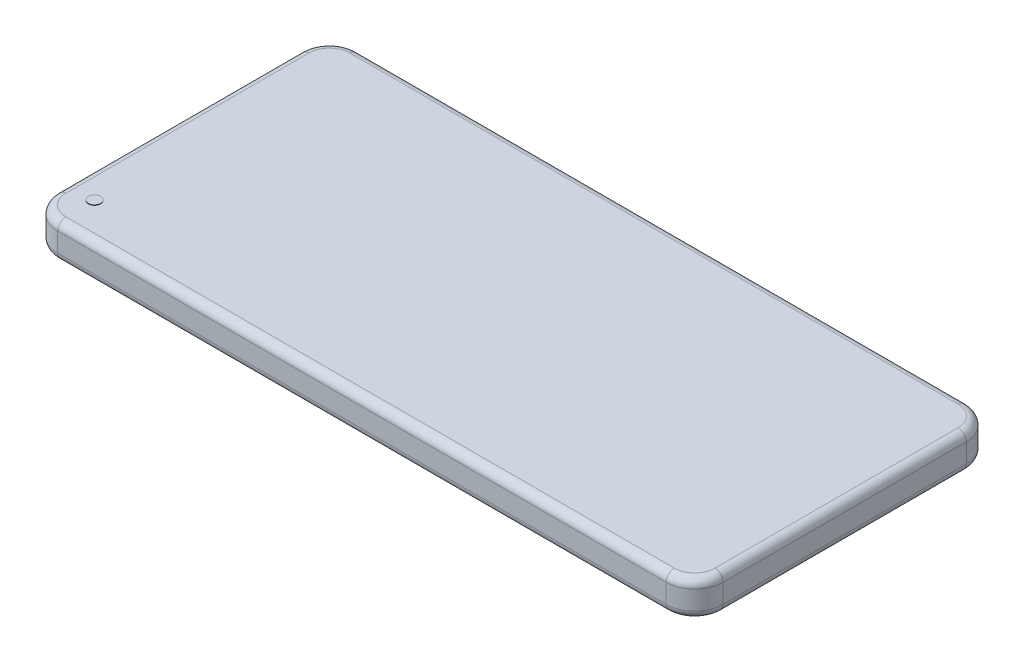
from build123d import *

# Parameters (mm, degrees)
SKETCH1_W           = 163.2
SKETCH1_H           = 73.6
BOSS_EXTRUDE1_DEPTH = 8.7
FILLET1_R           = 7
FILLET2_R           = 2
SKETCH2_R           = 1.5
BOSS_EXTRUDE2_DEPTH = 0.1
FILLET3_R           = 2
SKETCH3_W           = 40
SKETCH3_H           = 22
BOSS_EXTRUDE3_DEPTH = 1
FILLET4_R           = 4
CUT_EXTRUDE1_DEPTH  = 1
SKETCH5_R           = 5
SKETCH5_R_2         = 2.5
SKETCH5_R_3         = 2
BOSS_EXTRUDE4_DEPTH = 1
SKETCH6_R           = 4
SKETCH6_R_2         = 1.4
SKETCH6_R_3         = 1
BOSS_EXTRUDE5_DEPTH = 0.1


with BuildPart() as part:
    # Sketch1 → Boss-Extrude1 (new body)
    with BuildSketch(Plane(origin=(0, 0, 0), x_dir=(1, 0, 0), z_dir=(0, 1, 0))):
        Rectangle(SKETCH1_W, SKETCH1_H)
    extrude(amount=BOSS_EXTRUDE1_DEPTH)

    # Fillet1
    fillet1_edges = [part.edges().sort_by_distance(p)[0] for p in [
        (81.6, 4.35, 36.8),
        (-81.6, 4.35, 36.8),
        (-81.6, 4.35, -36.8),
        (81.6, 4.35, -36.8),
    ]]
    fillet(fillet1_edges, radius=FILLET1_R)

    # Fillet2
    fillet2_edges = [part.edges().sort_by_distance(p)[0] for p in [
        (81.6, 8.7, 0),
        (0, 8.7, 36.8),
        (0, 8.7, -36.8),
        (-81.6, 8.7, 0),
        (-79.549747468, 8.7, 34.749747468),
        (-79.549747468, 8.7, -34.749747468),
        (79.549747468, 8.7, -34.749747468),
        (79.549747468, 8.7, 34.749747468),
    ]]
    fillet(fillet2_edges, radius=FILLET2_R)

    # Sketch2 → Boss-Extrude2 (add)
    with BuildSketch(Plane(origin=(0, 8.7, 0), x_dir=(1, 0, 0), z_dir=(0, 1, 0))):
        with Locations(Location((-74.6, -27.8, 0), (0, 0, 90))):
            Circle(SKETCH2_R)
    extrude(amount=BOSS_EXTRUDE2_DEPTH)

    # Fillet3
    fillet3_edges = [part.edges().sort_by_distance(p)[0] for p in [
        (81.6, 0, 0),
        (0, 0, 36.8),
        (-81.6, 0, 0),
        (0, 0, -36.8),
        (-79.549747468, 0, 34.749747468),
        (-79.549747468, 0, -34.749747468),
        (79.549747468, 0, -34.749747468),
        (79.549747468, 0, 34.749747468),
    ]]
    fillet(fillet3_edges, radius=FILLET3_R)

    # Sketch3 → Boss-Extrude3 (add)
    with BuildSketch(Plane.XZ):
        with Locations((-54.6, -17.8)):
            Rectangle(SKETCH3_W, SKETCH3_H)
    extrude(amount=BOSS_EXTRUDE3_DEPTH)

    # Fillet4
    fillet4_edges = [part.edges().sort_by_distance(p)[0] for p in [
        (-74.6, -0.5, -6.8),
        (-74.6, -0.5, -28.8),
        (-34.6, -0.5, -28.8),
        (-34.6, -0.5, -6.8),
    ]]
    fillet(fillet4_edges, radius=FILLET4_R)

    # Sketch4 → Cut-Extrude1 (cut)
    with BuildSketch(Plane.XZ.offset(1)):
        with BuildLine():
            Line((-70.6, -27.8), (-38.6, -27.8))
            ThreePointArc((-38.6, -27.8), (-36.478679656, -26.921320344), (-35.6, -24.8))
            Line((-35.6, -24.8), (-35.6, -10.8))
            ThreePointArc((-35.6, -10.8), (-36.478679656, -8.678679656), (-38.6, -7.8))
            Line((-38.6, -7.8), (-70.6, -7.8))
            ThreePointArc((-70.6, -7.8), (-72.721320344, -8.678679656), (-73.6, -10.8))
            Line((-73.6, -10.8), (-73.6, -24.8))
            ThreePointArc((-73.6, -24.8), (-72.721320344, -26.921320344), (-70.6, -27.8))
        make_face()
    extrude(amount=-CUT_EXTRUDE1_DEPTH, mode=Mode.SUBTRACT)

    # Sketch5 → Boss-Extrude4 (add)
    with BuildSketch(Plane(origin=(0, 0, 0), x_dir=(-1, 0, 0), z_dir=(0, -1, 0))):
        with Locations(Location((66.6, 20.8, 0), (0, 0, 90))):
            Circle(SKETCH5_R)
        with Locations(Location((52.6, 20.8, 0), (0, 0, 90))):
            Circle(SKETCH5_R)
        with Locations(Location((40.6, 22.05, 0), (0, 0, 90))):
            Circle(SKETCH5_R_2)
        with Locations(Location((40.6, 13.55, 0), (0, 0, 90))):
            Circle(SKETCH5_R_2)
        with Locations(Location((59.6, 12.314718626, 0), (0, 0, 90))):
            Circle(SKETCH5_R_3)
    extrude(amount=BOSS_EXTRUDE4_DEPTH)

    # Sketch6 → Boss-Extrude5 (add)
    with BuildSketch(Plane.XZ.offset(1)):
        with Locations(Location((-66.6, -20.8, 0), (0, 0, 270))):
            Circle(SKETCH6_R)
        with Locations(Location((-52.6, -20.8, 0), (0, 0, 270))):
            Circle(SKETCH6_R)
        with Locations(Location((-40.6, -22.05, 0), (0, 0, 270))):
            Circle(SKETCH6_R_2)
        with Locations(Location((-40.6, -13.55, 0), (0, 0, 270))):
            Circle(SKETCH6_R_2)
        with Locations(Location((-59.6, -12.314718626, 0), (0, 0, 270))):
            Circle(SKETCH6_R_3)
    extrude(amount=BOSS_EXTRUDE5_DEPTH)


solid = part.part
